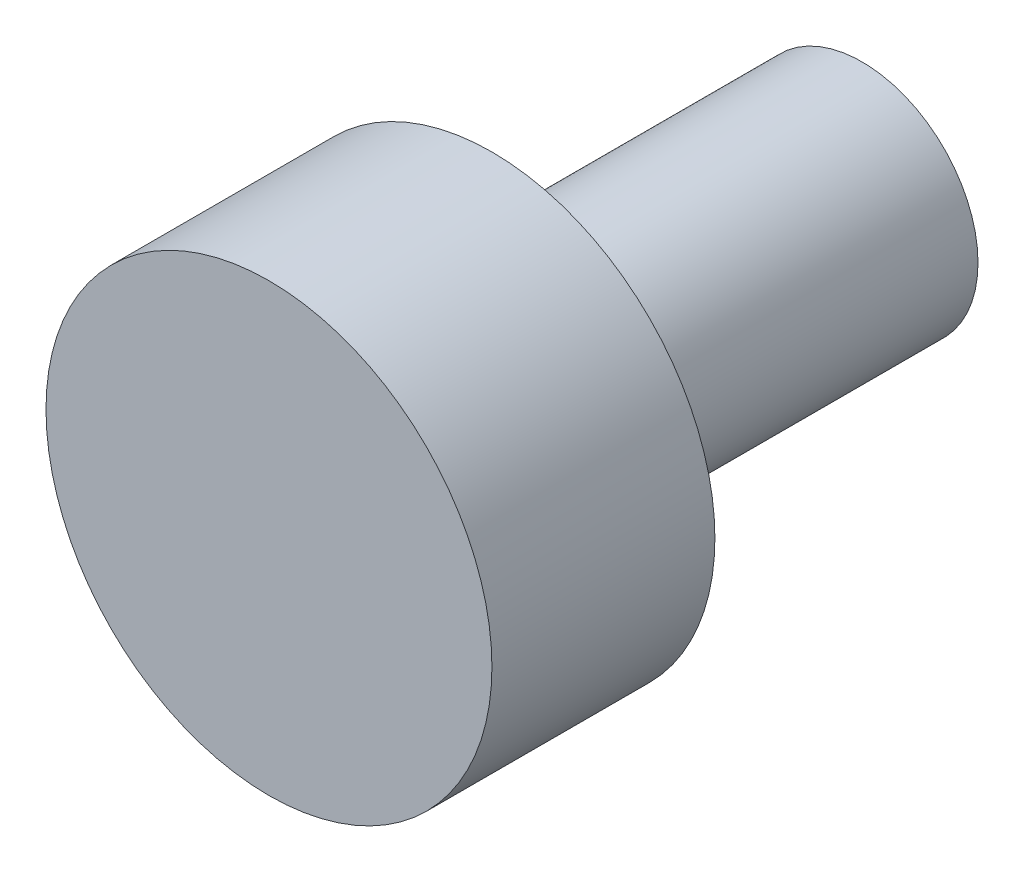
from build123d import *

# Parameters (mm, degrees)
ESQUISSE1_R             = 5
BOSS_EXTRU_1_DEPTH      = 5
ESQUISSE2_R             = 2.6
BOSS_EXTRU_2_DEPTH      = 8.3
ESQUISSE3_R             = 0.9
ENL_V_MAT_EXTRU_1_DEPTH = 7.5


with BuildPart() as part:
    # Esquisse1 → Boss.-Extru.1 (new body)
    with BuildSketch(Plane.XY):
        Circle(ESQUISSE1_R)
    extrude(amount=BOSS_EXTRU_1_DEPTH)

    # Esquisse2 → Boss.-Extru.2 (add)
    with BuildSketch(Plane(origin=(0, 0, 0), x_dir=(-1, 0, 0), z_dir=(0, 0, -1))):
        with Locations(Location((0, 0, 0), (0, 0, 180))):
            Circle(ESQUISSE2_R)
    extrude(amount=BOSS_EXTRU_2_DEPTH)

    # Esquisse3 → Enlèv. mat.-Extru.1 (cut)
    with BuildSketch(Plane(origin=(0, 0, -8.3), x_dir=(-1, 0, 0), z_dir=(0, 0, -1))):
        Circle(ESQUISSE3_R)
    extrude(amount=-ENL_V_MAT_EXTRU_1_DEPTH, mode=Mode.SUBTRACT)


solid = part.part
